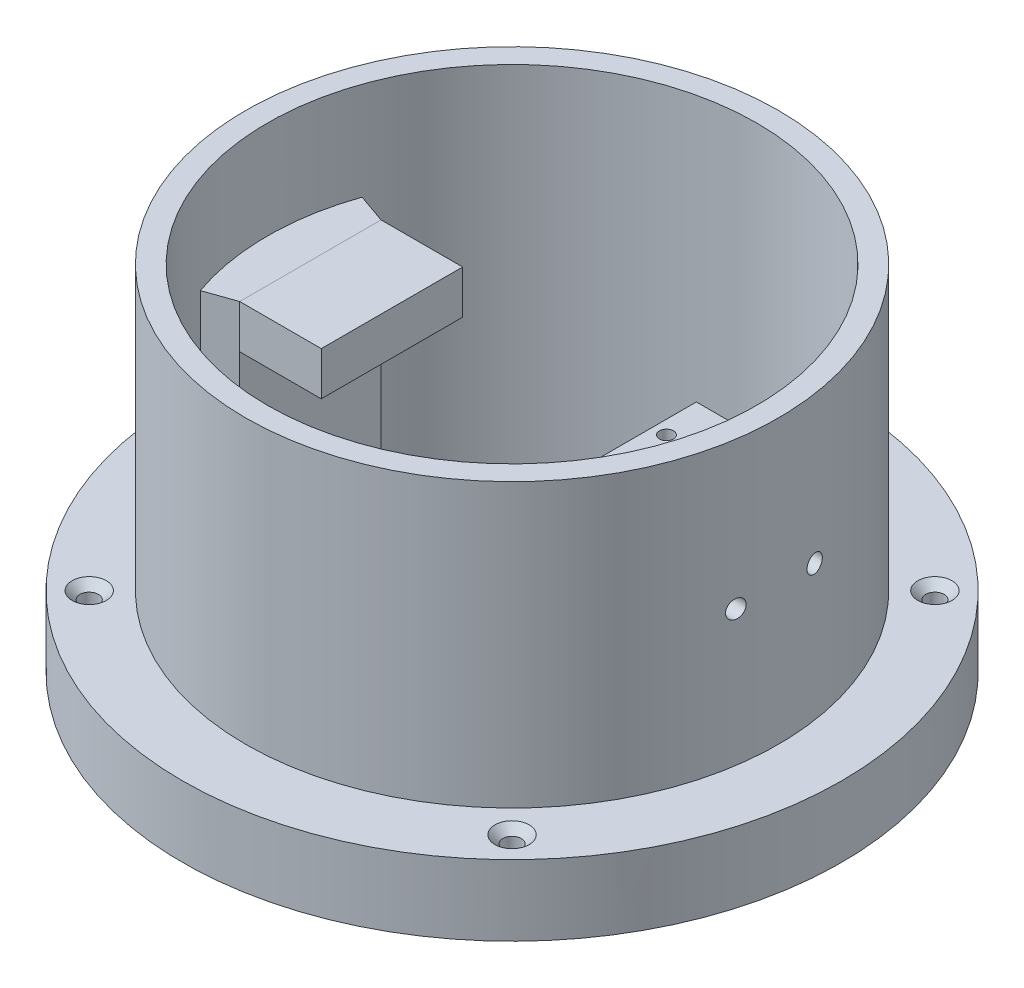
from build123d import *

# Parameters (mm, degrees)
SKETCH1_R                                    = 60.625
SKETCH1_R_2                                  = 45
BOSS_EXTRUDE1_DEPTH                          = 4
SKETCH2_R                                    = 49
SKETCH2_R_2                                  = 45
BOSS_EXTRUDE2_DEPTH                          = 52
SKETCH4_W                                    = 8
SKETCH4_H                                    = 38
BOSS_EXTRUDE4_DEPTH                          = 13
SKETCH4_W_2                                  = 15
SKETCH4_H_2                                  = 8
BOSS_EXTRUDE4_2_DEPTH                        = 13
BOSS_EXTRUDE5_DEPTH                          = 4
SKETCH7_R                                    = 1.3
CUT_EXTRUDE4_DEPTH                           = 7.2
SKETCH9_W                                    = 10
SKETCH9_H                                    = 24
CUT_EXTRUDE7_DEPTH                           = 8
CUT_EXTRUDE9_DEPTH                           = 101.273532151
CSK_FOR_M3_COUNTERSUNK_FLAT_HEAD_SCR_2_COUNT = 2
CSK_FOR_M3_COUNTERSUNK_FLAT_HEAD_SCR_2_PITCH = 77.781745931
CSK_FOR_M3_COUNTERSUNK_FLAT_HEAD_SCR_3_COUNT = 2
CSK_FOR_M3_COUNTERSUNK_FLAT_HEAD_SCR_3_PITCH = 110
CSK_FOR_M3_COUNTERSUNK_FLAT_HEAD_SCR_4_COUNT = 2
CSK_FOR_M3_COUNTERSUNK_FLAT_HEAD_SCR_4_PITCH = 77.781745931
SALIENTE_EXTRUIR1_DEPTH                      = 38
SALIENTE_EXTRUIR2_DEPTH                      = 38
CROQUIS7_R                                   = 7.5
CORTAR_EXTRUIR1_DEPTH                        = 38
CROQUIS9_R                                   = 1.65
CORTAR_EXTRUIR2_DEPTH                        = 117.007397393
CROQUIS12_R                                  = 60.625
CROQUIS12_R_2                                = 45
SALIENTE_EXTRUIR4_DEPTH                      = 9
CROQUIS14_R                                  = 1.7
CORTAR_EXTRUIR4_DEPTH                        = 101.273532203


with BuildPart() as part:
    # Sketch1 → Boss-Extrude1 (new body)
    with BuildSketch(Plane(origin=(0, 0, 0), x_dir=(1, 0, 0), z_dir=(0, 1, 0))):
        with Locations(Location((0, 0, 0), (0, 0, 270))):
            Circle(SKETCH1_R)
        with Locations(Location((0, 0, 0), (0, 0, 270))):
            Circle(SKETCH1_R_2, mode=Mode.SUBTRACT)
    extrude(amount=BOSS_EXTRUDE1_DEPTH)

    # Sketch2 → Boss-Extrude2 (add)
    with BuildSketch(Plane(origin=(0, 4, 0), x_dir=(1, 0, 0), z_dir=(0, 1, 0))):
        with Locations(Location((0, 0, 0), (0, 0, 90))):
            Circle(SKETCH2_R)
        with Locations(Location((0, 0, 0), (0, 0, 270))):
            Circle(SKETCH2_R_2, mode=Mode.SUBTRACT)
    extrude(amount=BOSS_EXTRUDE2_DEPTH)



with BuildPart() as body_2:
    # Sketch4 → Boss-Extrude4 (new, symmetric)
    with BuildSketch(Plane.XY):
        with Locations((24.9, 19)):
            Rectangle(SKETCH4_W, SKETCH4_H)
    extrude(amount=BOSS_EXTRUDE4_DEPTH, both=True)


with BuildPart() as body_3:
    # Sketch4 → Boss-Extrude4 2 (new, symmetric)
    with BuildSketch(Plane.XY):
        with Locations((-29.6, 34)):
            Rectangle(SKETCH4_W_2, SKETCH4_H_2)
    extrude(amount=BOSS_EXTRUDE4_2_DEPTH, both=True)


with BuildPart() as part_1:
    add(part.part)

    add(body_2.part)  # Boss-Extrude5 merges body 2
    # Sketch5 → Boss-Extrude5 (add)
    with BuildSketch(Plane.XZ):
        with BuildLine():
            Line((20.9, 13), (29.067400866, 34.352382842))
            ThreePointArc((29.067400866, 34.352382842), (45, 0), (29.067400866, -34.352382842))
            Line((29.067400866, -34.352382842), (20.9, -13))
            Line((20.9, -13), (20.9, 13))
        make_face()
    extrude(amount=-BOSS_EXTRUDE5_DEPTH)

    # Sketch7 → Cut-Extrude4 (cut)
    with BuildSketch(Plane(origin=(0, 38, 0), x_dir=(1, 0, 0), z_dir=(0, 1, 0))):
        with Locations((-24.6, 5)):
            Circle(SKETCH7_R)
        with Locations((-24.6, -5)):
            Circle(SKETCH7_R)
        with Locations(Location((23.4, 5, 0), (0, 0, 180))):
            Circle(SKETCH7_R)
        with Locations(Location((23.4, -5, 0), (0, 0, 180))):
            Circle(SKETCH7_R)
    extrude(amount=-CUT_EXTRUDE4_DEPTH, mode=Mode.SUBTRACT)

    # Sketch9 → Cut-Extrude7 (cut)
    with BuildSketch(Plane.ZY.offset(-20.9)):
        with Locations((0, 17)):
            Rectangle(SKETCH9_W, SKETCH9_H)
    extrude(amount=-CUT_EXTRUDE7_DEPTH, mode=Mode.SUBTRACT)

    # Sketch12 → Cut-Extrude9 (cut, through all)
    # profile 1 of 2: a face of its own
    with BuildSketch(Plane(origin=(0, 4, 0), x_dir=(1, 0, 0), z_dir=(0, 1, 0))):
        with BuildLine():
            Line((20.9, -13), (29.067400866, -34.352382842))
            ThreePointArc((29.067400866, -34.352382842), (45, 0), (29.067400866, 34.352382842))
            Line((29.067400866, 34.352382842), (20.9, 13))
            Line((20.9, 13), (28.9, 13))
            Line((28.9, 13), (28.9, -13))
            Line((28.9, -13), (20.9, -13))
        make_face()
        with BuildLine():
            Line((36.9, -2.718455444), (36.9, 2.718455444))
            ThreePointArc((36.9, 2.718455444), (37, 0), (36.9, -2.718455444))
        make_face(mode=Mode.SUBTRACT)
    # profile 2 of 2: a face of its own
    with BuildSketch(Plane(origin=(0, 4, 0), x_dir=(1, 0, 0), z_dir=(0, 1, 0))):
        with BuildLine():
            ThreePointArc((36.9, -2.718455444), (37, 0), (36.9, 2.718455444))
            Line((36.9, 2.718455444), (36.9, -2.718455444))
        make_face()
    extrude(amount=-CUT_EXTRUDE9_DEPTH, mode=Mode.SUBTRACT)


with BuildPart() as cut_extrude9_piece_1:
    # of the separate pieces the step leaves, piece 1, a body of its own (cut_extrude9_pieces)
    add(part_1.part.solids().sort_by_distance((0, 0, 60.625))[0])

    # Sketch17 → CSK for M3 Countersunk Flat Head Screw1 (revolve, cut)
    with BuildSketch(Plane(origin=(-38.890872965, 4, -38.890872965), x_dir=(0, 0, 1), z_dir=(1, 0, 0))):
        Polygon((0, 0), (0, 4.001), (1.7, 4.001), (1.7, 1.45), (3.15, 0), align=None)
    csk_for_m3_countersunk_flat_head_screw1 = revolve(axis=Axis((-38.890872965, 10.35, -38.890872965), (0, -1, 0)), mode=Mode.SUBTRACT)

    # CSK for M3 Countersunk Flat Head Scr 2: CSK for M3 Countersunk Flat Head Screw1 ×2
    with Locations(*[(0, 0, i * CSK_FOR_M3_COUNTERSUNK_FLAT_HEAD_SCR_2_PITCH) for i in range(1, CSK_FOR_M3_COUNTERSUNK_FLAT_HEAD_SCR_2_COUNT)]):
        add(csk_for_m3_countersunk_flat_head_screw1, mode=Mode.SUBTRACT)

    # CSK for M3 Countersunk Flat Head Scr 3: CSK for M3 Countersunk Flat Head Screw1 ×2
    with Locations(*[Vector(0.7071067811865713, 0, 0.7071067811865237) * (i * CSK_FOR_M3_COUNTERSUNK_FLAT_HEAD_SCR_3_PITCH) for i in range(1, CSK_FOR_M3_COUNTERSUNK_FLAT_HEAD_SCR_3_COUNT)]):
        add(csk_for_m3_countersunk_flat_head_screw1, mode=Mode.SUBTRACT)

    # CSK for M3 Countersunk Flat Head Scr 4: CSK for M3 Countersunk Flat Head Screw1 ×2
    with Locations(*[(i * CSK_FOR_M3_COUNTERSUNK_FLAT_HEAD_SCR_4_PITCH, 0, 0) for i in range(1, CSK_FOR_M3_COUNTERSUNK_FLAT_HEAD_SCR_4_COUNT)]):
        add(csk_for_m3_countersunk_flat_head_screw1, mode=Mode.SUBTRACT)



with BuildPart() as cut_extrude9_piece_2:
    # of the separate pieces the step leaves, piece 2, a body of its own (cut_extrude9_pieces)
    add(part_1.part.solids().sort_by_distance((20.9, 0, -13))[0])


with BuildPart() as cut_extrude9_piece_1_1:
    add(cut_extrude9_piece_1.part)

    add(cut_extrude9_piece_2.part)  # Saliente-Extruir1 merges Cut-Extrude9 piece 2
    # Croquis3 → Saliente-Extruir1 (add)
    with BuildSketch(Plane.XZ):
        Polygon((28.9, 13), (41.02948985, 18.481909063), (41.039124346, -18.460505761), (28.9, -13), align=None)
        with BuildLine():
            Line((-37.1, 13), (-42.468269464, 14.881064772))
            ThreePointArc((-42.468269464, 14.881064772), (-45, 0), (-42.468269464, -14.881064772))
            Line((-42.468269464, -14.881064772), (-37.1, -13))
            Line((-37.1, -13), (-37.1, 13))
        make_face()
    extrude(amount=-SALIENTE_EXTRUIR1_DEPTH)

    # Croquis6 → Saliente-Extruir2 (add)
    with BuildSketch(Plane(origin=(0, 0, 0), x_dir=(1, 0, 0), z_dir=(0, 1, 0))):
        Polygon((41.039124346, 18.460505761), (43.840051606, 18.460505761), (46.523602828, 6.268088211), (46.523602828, -4.665099601), (45, -15.515113827), (44.583260481, -18.482835878), (41.02948985, -18.481909063), align=None)
    extrude(amount=SALIENTE_EXTRUIR2_DEPTH)

    # Croquis7 → Cortar-Extruir1 (cut)
    with BuildSketch(Plane.XZ):
        with Locations(Location((34.115531068, 0, 0), (0, 0, 270))):
            Circle(CROQUIS7_R)
    extrude(amount=-CORTAR_EXTRUIR1_DEPTH, mode=Mode.SUBTRACT)

    # Croquis9 → Cortar-Extruir2 (cut, through all)
    with BuildSketch(Plane.ZY.offset(-20.9)):
        with Locations((-7.23, 28.95)):
            Circle(CROQUIS9_R)
        with Locations((7.27, 28.95)):
            Circle(CROQUIS9_R)
    extrude(amount=-CORTAR_EXTRUIR2_DEPTH, mode=Mode.SUBTRACT)

    # Croquis12 → Saliente-Extruir4 (add)
    with BuildSketch(Plane.XZ):
        with Locations(Location((0, 0, 0), (0, 0, 270))):
            Circle(CROQUIS12_R)
        with Locations(Location((0, 0, 0), (0, 0, 270))):
            Circle(CROQUIS12_R_2, mode=Mode.SUBTRACT)
    extrude(amount=SALIENTE_EXTRUIR4_DEPTH)

    # Croquis14 → Cortar-Extruir4 (cut, through all)
    with BuildSketch(Plane(origin=(0, 4, 0), x_dir=(1, 0, 0), z_dir=(0, 1, 0))):
        with Locations(Location((-38.890872965, 38.890872965, 0), (0, 0, 270))):
            Circle(CROQUIS14_R)
        with Locations(Location((38.890872965, 38.890872965, 0), (0, 0, 270))):
            Circle(CROQUIS14_R)
        with Locations(Location((38.890872965, -38.890872965, 0), (0, 0, 270))):
            Circle(CROQUIS14_R)
        with Locations(Location((-38.890872965, -38.890872965, 0), (0, 0, 270))):
            Circle(CROQUIS14_R)
    extrude(amount=-CORTAR_EXTRUIR4_DEPTH, mode=Mode.SUBTRACT)


solid = Compound([body_3.part, cut_extrude9_piece_1_1.part])
